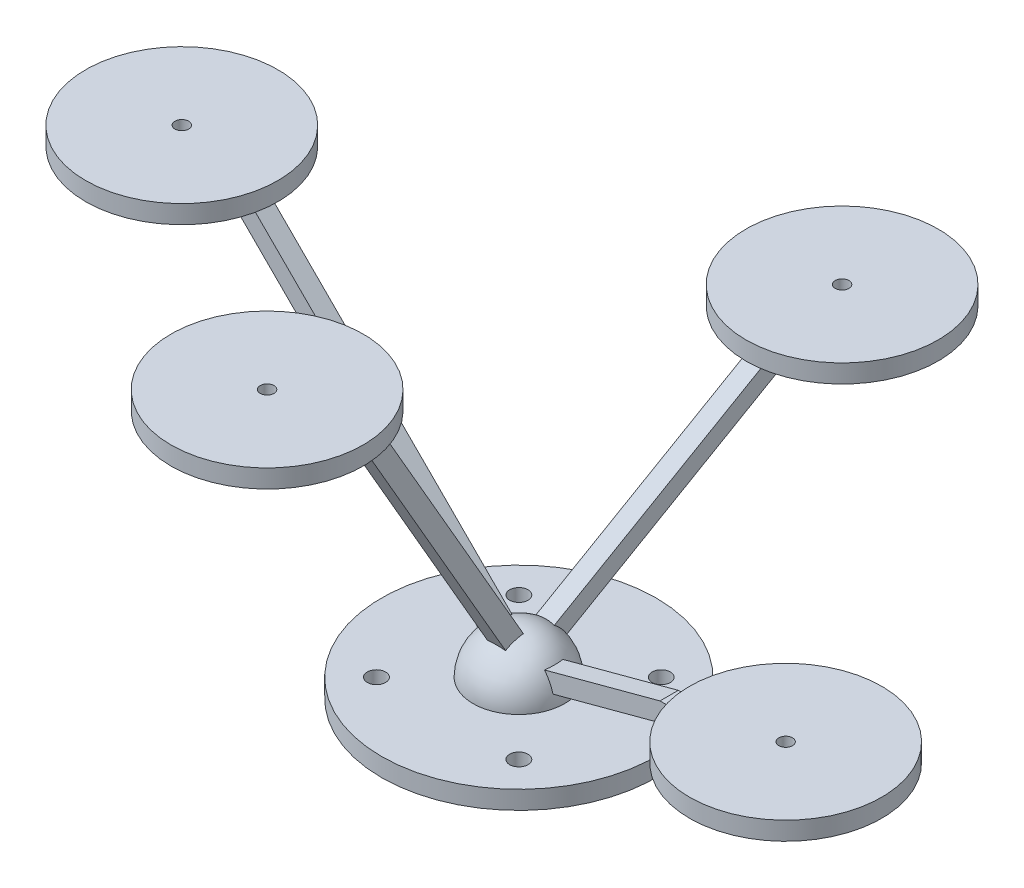
from build123d import *

# Parameters (mm, degrees)
SKETCH_1_R      = 15
SKETCH_1_R_2    = 1
EXTRUDE_1_DEPTH = 2
EXTRUDE_2_DEPTH = 1
SKETCH_4_R      = 10.5
SKETCH_4_R_2    = 0.75
EXTRUDE_3_DEPTH = 2
SKETCH_5_R      = 10.5
SKETCH_5_R_2    = 0.75
EXTRUDE_4_DEPTH = 2
EXTRUDE_5_DEPTH = 1
SKETCH_7_R      = 10.5
SKETCH_7_R_2    = 0.75
EXTRUDE_6_DEPTH = 2
SKETCH_8_R      = 10.5
SKETCH_8_R_2    = 0.75
EXTRUDE_7_DEPTH = 2


with BuildPart() as part:
    # 草图1 → 凸台-拉伸1 (new body)
    with BuildSketch(Plane(origin=(0, 0, 0), x_dir=(1, 0, 0), z_dir=(0, 1, 0))):
        with Locations(Location((0, 0, 0), (0, 0, 270))):
            Circle(SKETCH_1_R)
        with Locations(Location((7.778174593, 7.778174593, 0), (0, 0, 270))):
            Circle(SKETCH_1_R_2, mode=Mode.SUBTRACT)
        with Locations(Location((-7.778174593, 7.778174593, 0), (0, 0, 270))):
            Circle(SKETCH_1_R_2, mode=Mode.SUBTRACT)
        with Locations(Location((-7.778174593, -7.778174593, 0), (0, 0, 270))):
            Circle(SKETCH_1_R_2, mode=Mode.SUBTRACT)
        with Locations(Location((7.778174593, -7.778174593, 0), (0, 0, 270))):
            Circle(SKETCH_1_R_2, mode=Mode.SUBTRACT)
    extrude(amount=EXTRUDE_1_DEPTH)

    # 草图2 → 旋转1 (revolve)
    with BuildSketch(Plane(origin=(0, 0, 0), x_dir=(0, 0, -1), z_dir=(1, 0, 0))):
        with BuildLine():
            Line((0, 2), (0, 7))
            ThreePointArc((0, 7), (3.535533906, 5.535533906), (5, 2))
            Line((5, 2), (0, 2))
        make_face()
    revolve(axis=Axis((0, 2, 0), (0, 1, 0)))

    # 草图3 → 凸台-拉伸2 (add, symmetric)
    with BuildSketch(Plane.XY):
        Polygon((0, 2), (24.148145657, 8.470476128), (16.420739047, 8.470476128), (0, 4.070552361), (0, 4.828427125), (-28.991378029, 33.819805153), (-31.819805153, 33.819805153), align=None)
    extrude(amount=EXTRUDE_2_DEPTH, both=True)

    # 草图4 → 凸台-拉伸3 (add)
    with BuildSketch(Plane(origin=(0, 8.470476128, 0), x_dir=(1, 0, 0), z_dir=(0, 1, 0))):
        with Locations(Location((29.148145657, 0, 0), (0, 0, 174.5349762))):
            Circle(SKETCH_4_R)
        with Locations(Location((29.148145657, 0, 0), (0, 0, 270))):
            Circle(SKETCH_4_R_2, mode=Mode.SUBTRACT)
    extrude(amount=EXTRUDE_3_DEPTH)

    # 草图5 → 凸台-拉伸4 (add)
    with BuildSketch(Plane(origin=(0, 33.819805153, 0), x_dir=(1, 0, 0), z_dir=(0, 1, 0))):
        with Locations(Location((-36.819805153, 0, 0), (0, 0, 270))):
            Circle(SKETCH_5_R)
        with Locations(Location((-36.819805153, 0, 0), (0, 0, 270))):
            Circle(SKETCH_5_R_2, mode=Mode.SUBTRACT)
    extrude(amount=EXTRUDE_4_DEPTH)

    # 草图6 → 凸台-拉伸5 (add, symmetric)
    with BuildSketch(Plane(origin=(0, 0, 0), x_dir=(0, 0, -1), z_dir=(1, 0, 0))):
        Polygon((0, 2), (30.310889132, 19.5), (26.310889132, 19.5), (0, 4.309401077), (0, 6), (-20.190598923, 40.97114317), (-22.5, 40.97114317), align=None)
    extrude(amount=EXTRUDE_5_DEPTH, both=True)

    # 草图7 → 凸台-拉伸6 (add)
    with BuildSketch(Plane(origin=(0, 19.5, 0), x_dir=(1, 0, 0), z_dir=(0, 1, 0))):
        with Locations(Location((0, 35.310889132, 0), (0, 0, 270))):
            Circle(SKETCH_7_R)
        with Locations(Location((0, 35.310889132, 0), (0, 0, 270))):
            Circle(SKETCH_7_R_2, mode=Mode.SUBTRACT)
    extrude(amount=EXTRUDE_6_DEPTH)

    # 草图8 → 凸台-拉伸7 (add)
    with BuildSketch(Plane(origin=(0, 40.97114317, 0), x_dir=(1, 0, 0), z_dir=(0, 1, 0))):
        with Locations(Location((0, -27.5, 0), (0, 0, 270))):
            Circle(SKETCH_8_R)
        with Locations(Location((0, -27.5, 0), (0, 0, 270))):
            Circle(SKETCH_8_R_2, mode=Mode.SUBTRACT)
    extrude(amount=EXTRUDE_7_DEPTH)


solid = part.part
